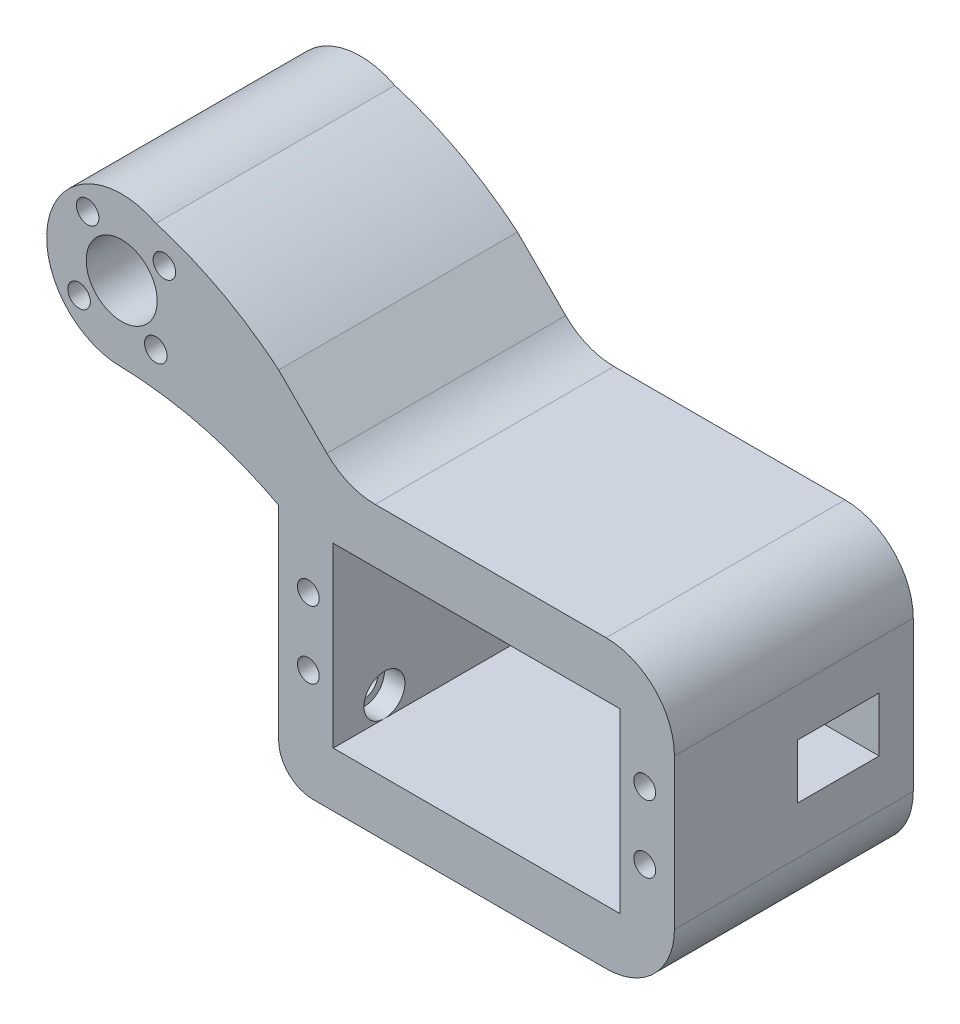
from build123d import *

# Parameters (mm, degrees)
SKETCH1_W           = 58
SKETCH1_H           = 42
SKETCH1_W_2         = 42
SKETCH1_H_2         = 26
BOSS_EXTRUDE1_DEPTH = 30
SKETCH2_W           = 58
SKETCH2_H           = 42
BOSS_EXTRUDE2_DEPTH = 5
SKETCH4_R           = 1.75
CUT_EXTRUDE2_DEPTH  = 8
SKETCH5_R           = 1.75
CUT_EXTRUDE3_DEPTH  = 8
SKETCH6_R           = 2
CUT_EXTRUDE4_DEPTH  = 8
CUT_EXTRUDE5_START  = 42
SKETCH7_R           = 3
CUT_EXTRUDE5_DEPTH  = 3
SKETCH8_W           = 38.12950039
SKETCH8_H           = 31.187364713
BOSS_EXTRUDE3_DEPTH = 35
SKETCH9_R           = 5.2
CUT_EXTRUDE6_DEPTH  = 89.074186757
SKETCH10_R          = 1.65
CUT_EXTRUDE7_DEPTH  = 15
FILLET1_R           = 10
CUT_EXTRUDE8_DEPTH  = 89.074186757
BOSS_EXTRUDE4_DEPTH = 35
FILLET2_R           = 10
SKETCH13_R          = 1.6
CUT_EXTRUDE9_DEPTH  = 15
SKETCH14_R          = 6.6
CUT_EXTRUDE10_DEPTH = 5
SKETCH15_W          = 12
SKETCH15_H          = 8
CUT_EXTRUDE11_DEPTH = 99.51675752
FILLET3_R           = 5


with BuildPart() as part:
    # Sketch1 → Boss-Extrude1 (new body)
    with BuildSketch(Plane.XY):
        Rectangle(SKETCH1_W, SKETCH1_H)
        Rectangle(SKETCH1_W_2, SKETCH1_H_2, mode=Mode.SUBTRACT)
    extrude(amount=BOSS_EXTRUDE1_DEPTH)

    # Sketch2 → Boss-Extrude2 (add)
    with BuildSketch(Plane(origin=(0, 0, 0), x_dir=(-1, 0, 0), z_dir=(0, 0, -1))):
        Rectangle(SKETCH2_W, SKETCH2_H)
    extrude(amount=BOSS_EXTRUDE2_DEPTH)

    # Sketch4 → Cut-Extrude2 (cut)
    with BuildSketch(Plane.ZY.offset(29)):
        with Locations(Location((22.5, 10, 0), (0, 0, 270))):
            Circle(SKETCH4_R)
        with Locations(Location((22.5, -10, 0), (0, 0, 270))):
            Circle(SKETCH4_R)
    extrude(amount=-CUT_EXTRUDE2_DEPTH, mode=Mode.SUBTRACT)

    # Sketch5 → Cut-Extrude3 (cut)
    with BuildSketch(Plane.ZY.offset(29)):
        with Locations(Location((2.5, 10, 0), (0, 0, 270))):
            Circle(SKETCH5_R)
        with Locations(Location((2.5, -10, 0), (0, 0, 270))):
            Circle(SKETCH5_R)
    extrude(amount=-CUT_EXTRUDE3_DEPTH, mode=Mode.SUBTRACT)

    # Sketch6 → Cut-Extrude4 (cut)
    with BuildSketch(Plane.ZY.offset(29)):
        with Locations(Location((22.5, 10, 0), (0, 0, 270))):
            Circle(SKETCH6_R)
        with Locations(Location((2.5, 10, 0), (0, 0, 270))):
            Circle(SKETCH6_R)
        with Locations(Location((2.5, -10, 0), (0, 0, 270))):
            Circle(SKETCH6_R)
        with Locations(Location((22.5, -10, 0), (0, 0, 270))):
            Circle(SKETCH6_R)
    extrude(amount=-CUT_EXTRUDE4_DEPTH, mode=Mode.SUBTRACT)

    # Sketch7 → Cut-Extrude5 (cut)
    with BuildSketch(Plane.ZY.offset(-21).offset(CUT_EXTRUDE5_START)):
        with Locations(Location((22.5, 10, 0), (0, 0, 90))):
            Circle(SKETCH7_R)
        with Locations(Location((22.5, -10, 0), (0, 0, 180))):
            Circle(SKETCH7_R)
        with Locations(Location((2.5, 10, 0), (0, 0, 90))):
            Circle(SKETCH7_R)
        with Locations(Location((2.5, -10, 0), (0, 0, 146.442690238))):
            Circle(SKETCH7_R)
    extrude(amount=CUT_EXTRUDE5_DEPTH, mode=Mode.SUBTRACT)

    # Sketch8 → Boss-Extrude3 (add)
    with BuildSketch(Plane.XY.offset(30)):
        with Locations((-48.064750195, 29.414011989)):
            Rectangle(SKETCH8_W, SKETCH8_H)
    extrude(amount=-BOSS_EXTRUDE3_DEPTH)

    # Sketch9 → Cut-Extrude6 (cut, through all)
    with BuildSketch(Plane.XY.offset(30)):
        with Locations((-52.000004001, 30.827632123)):
            Circle(SKETCH9_R)
    extrude(amount=-CUT_EXTRUDE6_DEPTH, mode=Mode.SUBTRACT)

    # Sketch10 → Cut-Extrude7 (cut)
    with BuildSketch(Plane.XY.offset(30)):
        with Locations((-45.750541353, 35.822050669)):
            Circle(SKETCH10_R)
        with Locations((-47.005585454, 24.578169475)):
            Circle(SKETCH10_R)
        with Locations((-56.994422547, 37.07709477)):
            Circle(SKETCH10_R)
        with Locations((-58.249466648, 25.833213576)):
            Circle(SKETCH10_R)
    extrude(amount=-CUT_EXTRUDE7_DEPTH, mode=Mode.SUBTRACT)

    # Fillet1
    fillet1_edges = [part.edges().sort_by_distance(p)[0] for p in [
        (-67.12950039, 45.007694345, 12.5),
        (-67.12950039, 13.820329632, 12.5),
        (-29, 45.007694345, 12.5),
        (-29, 21, 12.5),
        (29, 21, 12.5),
        (29, -21, 12.5),
    ]]
    fillet(fillet1_edges, radius=FILLET1_R)

    # Sketch11 → Cut-Extrude8 (cut, through all)
    with BuildSketch(Plane.XY.offset(30)):
        with BuildLine():
            Line((-57.12950039, 13.820329632), (-29, 13.820329632))
            add(Edge.make_bspline(
                [(-52.000004001, 19.827632123), (-39.662764049, 19.484687558), (-29, 13.820329632)],
                knots=[0, 0, 0, 1, 1, 1], degree=2))
            ThreePointArc((-52.000004001, 19.827632123), (-62.690470456, 33.418756776), (-46.963580148, 40.606918128))
            add(Edge.make_bspline(
                [(-29, 31), (-36.987178252, 37.635549332), (-46.963580148, 40.606918128)],
                knots=[0, 0, 0, 1, 1, 1], degree=2))
            Line((-29, 31), (-29, 35.007694345))
            ThreePointArc((-29, 35.007694345), (-31.928932188, 42.078762157), (-39, 45.007694345))
            Line((-39, 45.007694345), (-57.12950039, 45.007694345))
            ThreePointArc((-57.12950039, 45.007694345), (-64.200568202, 42.078762157), (-67.12950039, 35.007694345))
            Line((-67.12950039, 35.007694345), (-67.12950039, 23.820329632))
            ThreePointArc((-67.12950039, 23.820329632), (-64.200568202, 16.74926182), (-57.12950039, 13.820329632))
        make_face()
    extrude(amount=-CUT_EXTRUDE8_DEPTH, mode=Mode.SUBTRACT)

    # Sketch12 → Boss-Extrude4 (add)
    with BuildSketch(Plane.XY.offset(30)):
        with BuildLine():
            Line((-29, 31), (-19, 21))
            ThreePointArc((-19, 21), (-26.071067812, 23.928932188), (-29, 31))
        make_face()
    extrude(amount=-BOSS_EXTRUDE4_DEPTH)

    # Fillet2
    fillet2_edges = [part.edges().sort_by_distance(p)[0] for p in [
        (-19, 21, 12.5),
    ]]
    fillet(fillet2_edges, radius=FILLET2_R)

    # Sketch13 → Cut-Extrude9 (cut)
    with BuildSketch(Plane.XY.offset(30)):
        with Locations((24.65, 4.935)):
            Circle(SKETCH13_R)
        with Locations((24.65, -4.935)):
            Circle(SKETCH13_R)
        with Locations((-24.65, 4.935)):
            Circle(SKETCH13_R)
        with Locations((-24.65, -4.935)):
            Circle(SKETCH13_R)
    extrude(amount=-CUT_EXTRUDE9_DEPTH, mode=Mode.SUBTRACT)

    # Sketch14 → Cut-Extrude10 (cut)
    with BuildSketch(Plane(origin=(0, 0, -5), x_dir=(-1, 0, 0), z_dir=(0, 0, -1))):
        with Locations((-10.250000003, -1e-09)):
            Circle(SKETCH14_R)
    extrude(amount=-CUT_EXTRUDE10_DEPTH, mode=Mode.SUBTRACT)

    # Sketch15 → Cut-Extrude11 (cut, through all)
    with BuildSketch(Plane.ZY.offset(-21)):
        with Locations((6, 0)):
            Rectangle(SKETCH15_W, SKETCH15_H)
    extrude(amount=-CUT_EXTRUDE11_DEPTH, mode=Mode.SUBTRACT)

    # Fillet3
    fillet3_edges = [part.edges().sort_by_distance(p)[0] for p in [
        (-29, -21, 12.5),
    ]]
    fillet(fillet3_edges, radius=FILLET3_R)


solid = part.part
